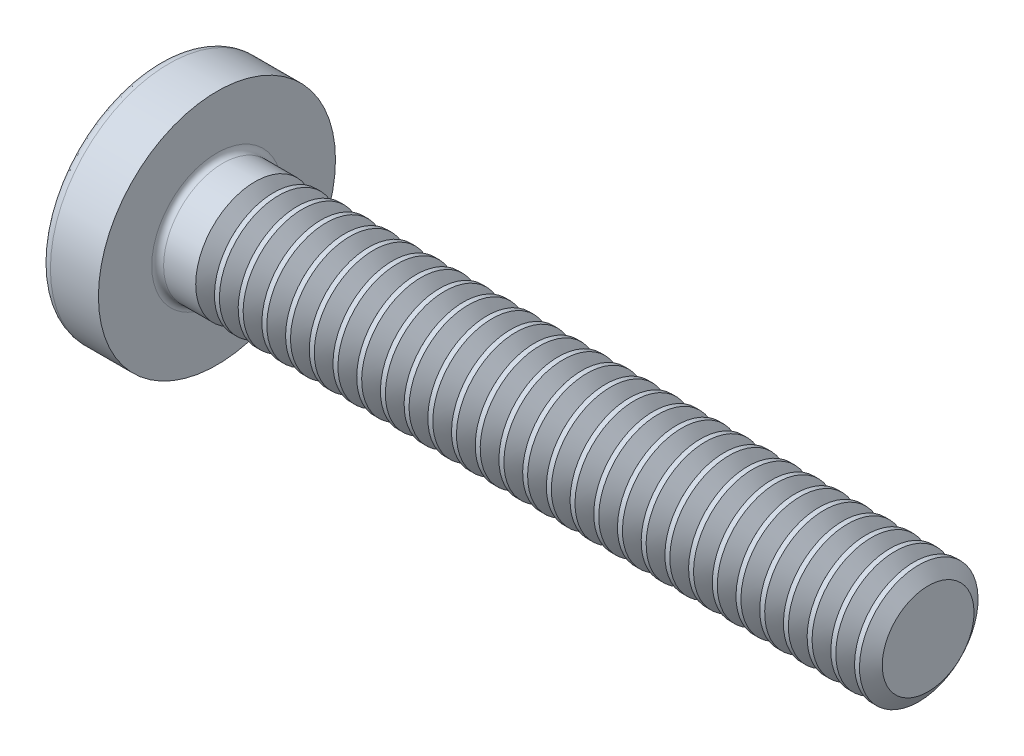
from build123d import *

# Parameters (mm, degrees)
FILLET1_R       = 0.1
RECPAT_COUNT    = 2
RECPAT_ANGLE    = 90
THDSCHPAT_COUNT = 29
THDSCHPAT_PITCH = 0.4


with BuildPart() as part:
    # BodySke → Base-Revolve (revolve)
    with BuildSketch(Plane.XY, mode=Mode.PRIVATE) as base_revolve_sk:
        with BuildLine():
            Line((1.6, 1), (1.6, 2))
            Line((1.6, 2), (0.790020747, 2))
            ThreePointArc((0.790020747, 2), (0.709789294, 1.981130115), (0.646379599, 1.928476821))
            ThreePointArc((0.646379599, 1.928476821), (0.165895084, 1.016959861), (0, 0))
            Line((0, 0), (13.6, 0))
            Line((13.6, 0), (13.6, 1))
            Line((13.6, 1), (1.6, 1))
        make_face()
    revolve(base_revolve_sk.sketch.rotate(Axis((0.790020747, 0, 0), (1, 0, 0)), 90), axis=Axis((0.790020747, 0, 0), (1, 0, 0)))

    # Fillet1
    fillet1_edges = [part.edges().sort_by_distance(p)[0] for p in [
        (1.6, 0, -1),
    ]]
    fillet(fillet1_edges, radius=FILLET1_R)

    # Sketch3 → Recess section 0
    with BuildSketch(Plane(origin=(0, 0, 0), x_dir=(0, 0, -1), z_dir=(1, 0, 0))):
        with BuildLine():
            Line((0.24, -1.05), (-0.24, -1.05))
            Line((-0.24, -1.05), (-0.24, 1.05))
            Line((-0.24, 1.05), (0.24, 1.05))
            Line((0.24, 1.05), (0.24, -1.05))
        make_face()
    # Sketch4 → Recess section 1
    with BuildSketch(Plane(origin=(1.42, 0, 0), x_dir=(0, 0, -1), z_dir=(1, 0, 0))):
        with BuildLine():
            Line((0.24, -0.342014235), (-0.24, -0.342014235))
            Line((-0.24, -0.342014235), (-0.24, 0.342014235))
            Line((-0.24, 0.342014235), (0.24, 0.342014235))
            Line((0.24, 0.342014235), (0.24, -0.342014235))
        make_face()
    recess = loft(mode=Mode.SUBTRACT)

    # RecPat: Recess ×2 about axis
    recpat_axis = Axis((0, 0, 0), (1, 0, 0))
    for i in range(1, RECPAT_COUNT):
        add(recess.rotate(recpat_axis, i * RECPAT_ANGLE / (RECPAT_COUNT - 1)), mode=Mode.SUBTRACT)

    # RecCorSke → RecessCore (revolve, cut)
    with BuildSketch(Plane.XY, mode=Mode.PRIVATE) as recesscore_sk:
        Polygon((0, 0), (0, 0.454796073), (1.42, 0.3555), (1.535508952, 0), align=None)
    revolve(recesscore_sk.sketch.rotate(Axis((-3.175, 0, 0), (1, 0, 0)), 13.894577695), axis=Axis((-3.175, 0, 0), (1, 0, 0)), mode=Mode.SUBTRACT)

    # ThdSchSke → ThreadSchematic (revolve, cut)
    with BuildSketch(Plane.XY, mode=Mode.PRIVATE) as threadschematic_sk:
        Polygon((2.4, -0.774), (2.241753096, -1), (2.241753096, -1.25), (2.558246904, -1.25), (2.558246904, -1), align=None)
    threadschematic = revolve(threadschematic_sk.sketch.rotate(Axis((-3.175, 0, 0), (1, 0, 0)), 270), axis=Axis((-3.175, 0, 0), (1, 0, 0)), mode=Mode.SUBTRACT)

    # ThdSchPat: ThreadSchematic ×29
    with Locations(*[(i * THDSCHPAT_PITCH, 0, 0) for i in range(1, THDSCHPAT_COUNT)]):
        add(threadschematic, mode=Mode.SUBTRACT)


solid = part.part
